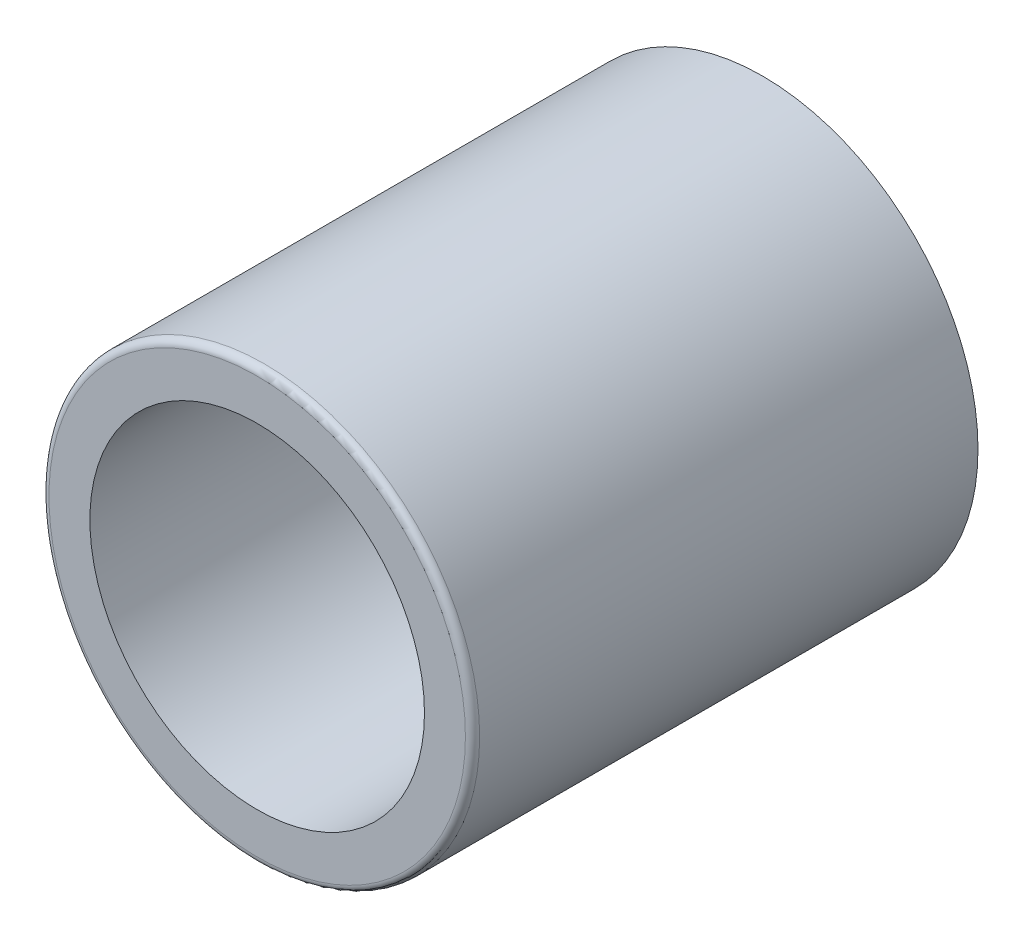
from build123d import *

# Parameters (mm, degrees)
CROQUIS1_R              = 6.05
CROQUIS1_R_2            = 4.7
SALIENTE_EXTRUIR1_DEPTH = 14.2
REDONDEO1_R             = 0.2


with BuildPart() as part:
    # Croquis1 → Saliente-Extruir1 (new body)
    with BuildSketch(Plane.XY):
        Circle(CROQUIS1_R)
        Circle(CROQUIS1_R_2, mode=Mode.SUBTRACT)
    extrude(amount=SALIENTE_EXTRUIR1_DEPTH)

    # Redondeo1
    redondeo1_edges = [part.edges().sort_by_distance(p)[0] for p in [
        (-6.05, 0, 14.2),
    ]]
    fillet(redondeo1_edges, radius=REDONDEO1_R)


solid = part.part
